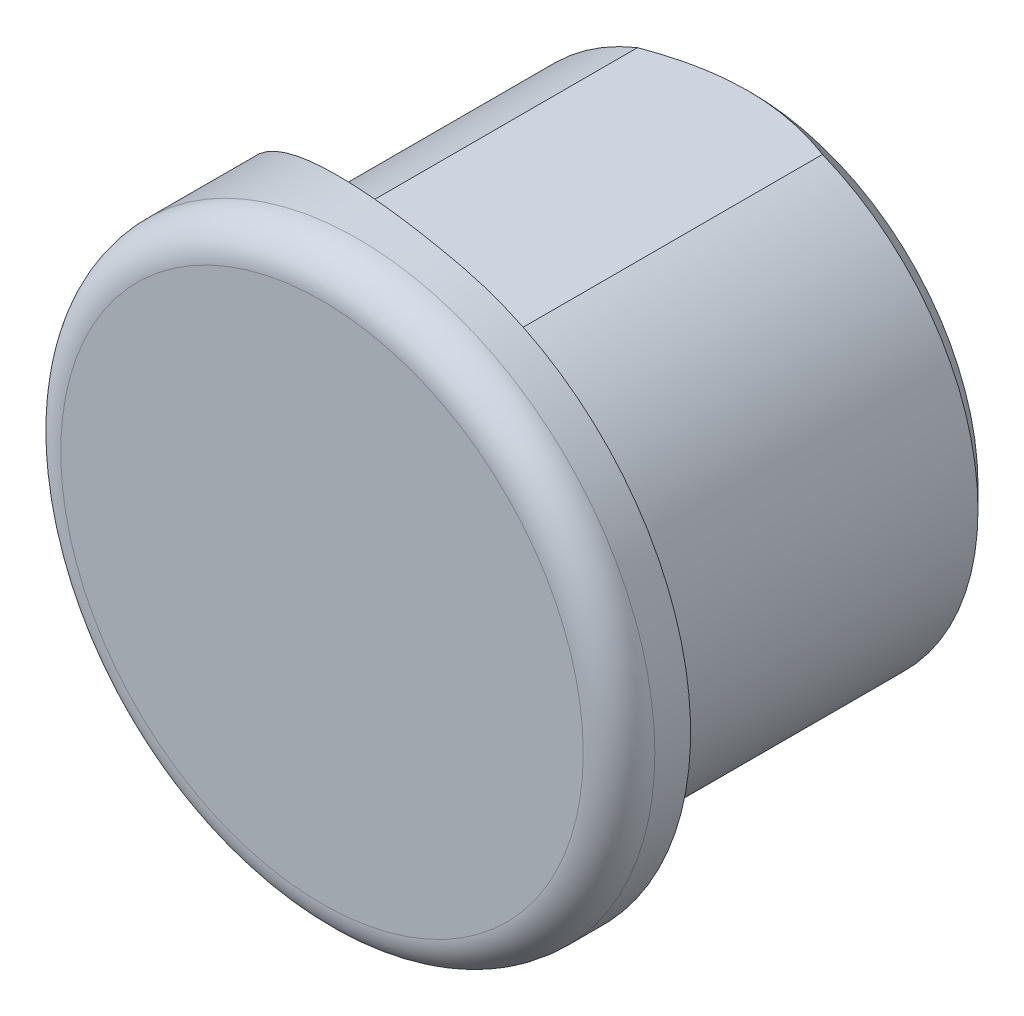
from build123d import *

# Parameters (mm, degrees)
ESQUISSE1_R                  = 3.465
BOSS_EXTRU_1_DEPTH           = 5
ESQUISSE2_R                  = 4.15
BOSS_EXTRU_2_DEPTH           = 1
CONG_1_R                     = 0.5
BOSS_EXTRU_3_DEPTH           = 9
BOSS_EXTRU_3_DEPTH_BACK      = 2
ENL_V_START                  = -4
ENL_V_MAT_EXTRU_1_DEPTH      = 4
CHANFREIN1_SIZE              = 0.3
ENL_V_MAT_EXTRU_2_REACH      = 84.915
ENL_V_MAT_EXTRU_2_END_RADIUS = 8


with BuildPart() as part:
    # Esquisse1 → Boss.-Extru.1 (new body)
    with BuildSketch(Plane.XY):
        with Locations((-38, 67)):
            Circle(ESQUISSE1_R)
    extrude(amount=-BOSS_EXTRU_1_DEPTH)

    # Esquisse2 → Boss.-Extru.2 (add)
    with BuildSketch(Plane.XY):
        with Locations((-38, 67)):
            Circle(ESQUISSE2_R)
    extrude(amount=BOSS_EXTRU_2_DEPTH)

    # Congé1
    cong_1_edges = [part.edges().sort_by_distance(p)[0] for p in [
        (-42.15, 67, 1),
    ]]
    fillet(cong_1_edges, radius=CONG_1_R)

    # Esquisse4 → Boss.-Extru.3 (add, two sides: drawn at the far end of the back side and taken through both)
    with BuildSketch(Plane(origin=(29.785, 71.15, 0), x_dir=(0, 0, 1), z_dir=(0, -1, 0)).offset(-BOSS_EXTRU_3_DEPTH_BACK)):
        with BuildLine():
            Line((0, 71.935), (-1.84883954, 71.935))
            ThreePointArc((-1.84883954, 71.935), (-0.476394359, 69.539440781), (0, 66.82))
            Line((0, 66.82), (0, 71.935))
        make_face()
    extrude(amount=BOSS_EXTRU_3_DEPTH + BOSS_EXTRU_3_DEPTH_BACK)

    # Esquisse5 → Enlèv. mat.-Extru.1 (cut)
    with BuildSketch(Plane.XY.offset(1).offset(ENL_V_START)):
        with BuildLine():
            Line((-37.035, 62.963754839), (-36.628505561, 58.672971398))
            Line((-36.628505561, 58.672971398), (-43.808246532, 59.466119951))
            Line((-43.808246532, 59.466119951), (-42.997006725, 73.486489438))
            Line((-42.997006725, 73.486489438), (-36.628505561, 73.524507843))
            Line((-36.628505561, 73.524507843), (-37.035, 71.036245161))
            ThreePointArc((-37.035, 71.036245161), (-40.57077323, 70.25785589), (-42.15, 67))
            ThreePointArc((-42.15, 67), (-40.57077323, 63.74214411), (-37.035, 62.963754839))
        make_face()
    extrude(amount=ENL_V_MAT_EXTRU_1_DEPTH, mode=Mode.SUBTRACT)

    # Chanfrein1
    chanfrein1_edges = [part.edges().sort_by_distance(p)[0] for p in [
        (-41.465, 67, -5),
    ]]
    chamfer(chanfrein1_edges, length=CHANFREIN1_SIZE)

    # Enlèv. mat.-Extru.2: up to this cylinder (the profile starts inside it)
    enl_v_mat_extru_2_end = Plane(origin=(-37.035, 70.315316, -8), z_dir=(0, -1, 0)) * Cylinder(ENL_V_MAT_EXTRU_2_END_RADIUS, 186.83, mode=Mode.PRIVATE)
    # Esquisse7 → Enlèv. mat.-Extru.2 (cut, up to the surface)
    with BuildSketch(Plane(origin=(0, 0, -5), x_dir=(-1, 0, 0), z_dir=(0, 0, -1)), mode=Mode.PRIVATE) as enl_v_mat_extru_2_sk1:
        with BuildLine():
            Line((36.707715202, 70.215), (39.292284798, 70.215))
            ThreePointArc((39.292284798, 70.215), (38.173107277, 70.460673182), (37.035, 70.327912258))
            ThreePointArc((37.035, 70.327912258), (36.869946479, 70.275546373), (36.707715202, 70.215))
        make_face()
    enl_v_mat_extru_2_tool1 = extrude(enl_v_mat_extru_2_sk1.sketch, amount=-ENL_V_MAT_EXTRU_2_REACH, mode=Mode.PRIVATE) & enl_v_mat_extru_2_end
    add(enl_v_mat_extru_2_tool1.solids().sort_by_distance((-38, 70.315316, -5))[0], mode=Mode.SUBTRACT)


solid = part.part
